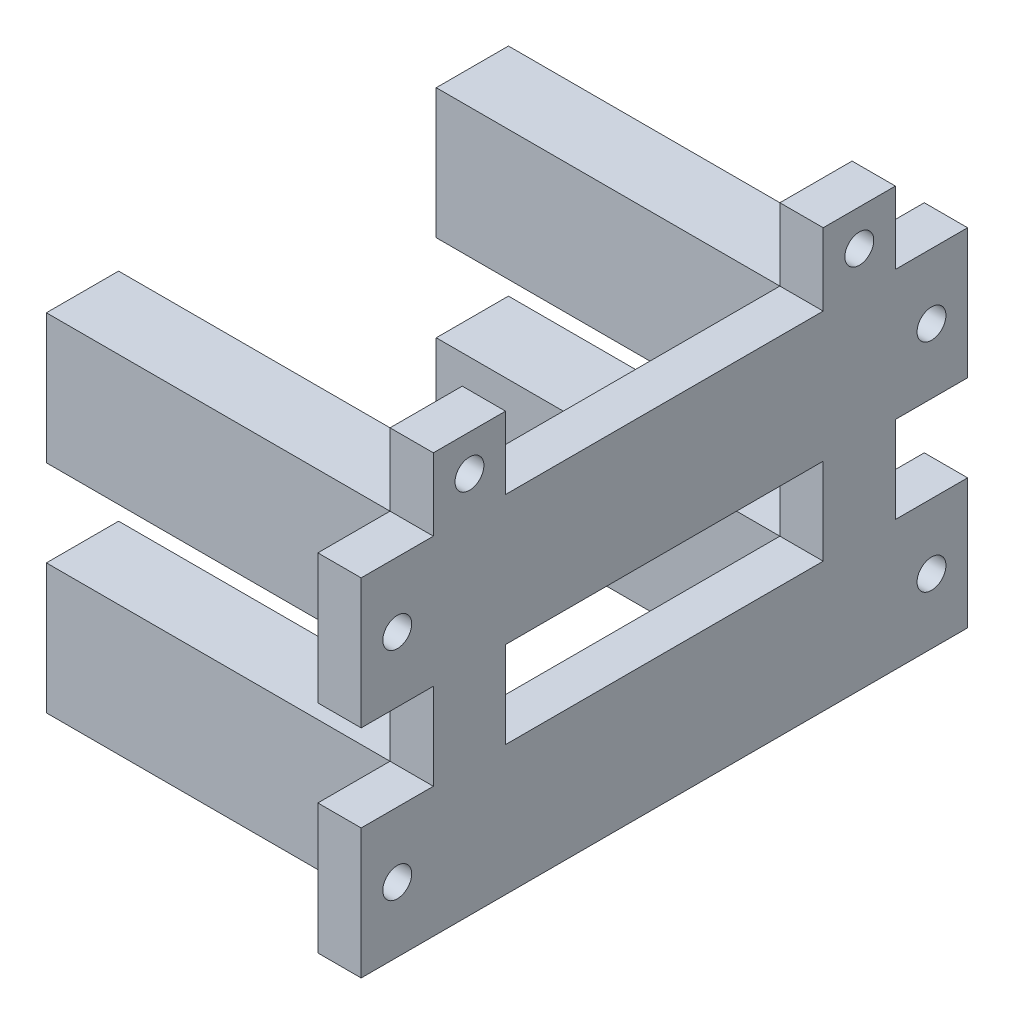
from build123d import *

# Parameters (mm, degrees)
SKETCH_1_W           = 32
SKETCH_1_H           = 24
EXTRUDE_1_DEPTH      = 23.8
SKETCH_7_R           = 0.65
CUT_EXTRUDE_1_DEPTH  = 2
SKETCH_8_OUTSIDE_W   = 43.31
SKETCH_8_OUTSIDE_H   = 35.31
SKETCH_8_OUTSIDE_W_2 = 5
SKETCH_8_OUTSIDE_H_2 = 9
CUT_EXTRUDE_2_DEPTH  = 32.087618114
SKETCH_9_R           = 1
SKETCH_9_W           = 22
SKETCH_9_H           = 6
EXTRUDE_2_DEPTH      = 3
SKETCH_11_R          = 1.75
CUT_EXTRUDE_3_DEPTH  = 1.5


with BuildPart() as part:
    # 草图1 → 凸台-拉伸1 (new body)
    with BuildSketch(Plane(origin=(0, 0, 0), x_dir=(0, 0, -1), z_dir=(1, 0, 0))):
        Rectangle(SKETCH_1_W, SKETCH_1_H)
    extrude(amount=EXTRUDE_1_DEPTH)

    # 草图7 → 切除-拉伸1 (cut)
    with BuildSketch(Plane.ZY):
        with Locations((13.5, 7.5)):
            Circle(SKETCH_7_R)
        with Locations((13.5, -7.5)):
            Circle(SKETCH_7_R)
        with Locations((-13.5, -7.5)):
            Circle(SKETCH_7_R)
        with Locations((-13.5, 7.5)):
            Circle(SKETCH_7_R)
    extrude(amount=-CUT_EXTRUDE_1_DEPTH, mode=Mode.SUBTRACT)

    # 草图8 outside → 切除-拉伸2 (cut, through all)
    with BuildSketch(Plane.ZY):
        Rectangle(SKETCH_8_OUTSIDE_W, SKETCH_8_OUTSIDE_H)
        with Locations((-13.5, -7.5)):
            Rectangle(SKETCH_8_OUTSIDE_W_2, SKETCH_8_OUTSIDE_H_2, mode=Mode.SUBTRACT)
        with Locations((-13.5, 7.5)):
            Rectangle(SKETCH_8_OUTSIDE_W_2, SKETCH_8_OUTSIDE_H_2, mode=Mode.SUBTRACT)
        with Locations((13.5, -7.5)):
            Rectangle(SKETCH_8_OUTSIDE_W_2, SKETCH_8_OUTSIDE_H_2, mode=Mode.SUBTRACT)
        with Locations((13.5, 7.5)):
            Rectangle(SKETCH_8_OUTSIDE_W_2, SKETCH_8_OUTSIDE_H_2, mode=Mode.SUBTRACT)
    extrude(amount=-CUT_EXTRUDE_2_DEPTH, mode=Mode.SUBTRACT)


with BuildPart() as cut_extrude_2_piece_1:
    # of the separate pieces the step leaves, piece 1, a body of its own (cut_extrude_2_pieces)
    add(part.part.solids().sort_by_distance((0, 12, 16))[0])



with BuildPart() as cut_extrude_2_piece_2:
    # of the separate pieces the step leaves, piece 2, a body of its own (cut_extrude_2_pieces)
    add(part.part.solids().sort_by_distance((0, -12, 16))[0])


with BuildPart() as cut_extrude_2_piece_3:
    # of the separate pieces the step leaves, piece 3, a body of its own (cut_extrude_2_pieces)
    add(part.part.solids().sort_by_distance((0, 3, -11))[0])


with BuildPart() as cut_extrude_2_piece_4:
    # of the separate pieces the step leaves, piece 4, a body of its own (cut_extrude_2_pieces)
    add(part.part.solids().sort_by_distance((0, -12, -11))[0])


with BuildPart() as cut_extrude_2_piece_1_1:
    add(cut_extrude_2_piece_1.part)

    add(cut_extrude_2_piece_2.part)  # 凸台-拉伸2 merges 切除-拉伸2 piece 2

    add(cut_extrude_2_piece_3.part)  # 凸台-拉伸2 merges 切除-拉伸2 piece 3

    add(cut_extrude_2_piece_4.part)  # 凸台-拉伸2 merges 切除-拉伸2 piece 4
    # 草图9 → 凸台-拉伸2 (add)
    with BuildSketch(Plane(origin=(23.8, 0, 0), x_dir=(0, 0, -1), z_dir=(1, 0, 0))):
        Polygon((16, -3), (16, 3), (21, 3), (21, 12), (16, 12), (16, 17), (11, 17), (11, 12), (-11, 12), (-11, 17), (-16, 17), (-16, 12), (-21, 12), (-21, 3), (-16, 3), (-16, -3), (-21, -3), (-21, -12), (21, -12), (21, -3), align=None)
        with Locations((18.5, 7.5)):
            Circle(SKETCH_9_R, mode=Mode.SUBTRACT)
        with Locations((13.5, 14.5)):
            Circle(SKETCH_9_R, mode=Mode.SUBTRACT)
        with Locations((-18.5, -7.5)):
            Circle(SKETCH_9_R, mode=Mode.SUBTRACT)
        with Locations((18.5, -7.5)):
            Circle(SKETCH_9_R, mode=Mode.SUBTRACT)
        Rectangle(SKETCH_9_W, SKETCH_9_H, mode=Mode.SUBTRACT)
        with Locations((-18.5, 7.5)):
            Circle(SKETCH_9_R, mode=Mode.SUBTRACT)
        with Locations((-13.5, 14.5)):
            Circle(SKETCH_9_R, mode=Mode.SUBTRACT)
    extrude(amount=EXTRUDE_2_DEPTH)

    # 草图11 → 切除-拉伸3 (cut)
    with BuildSketch(Plane.ZY.offset(-23.8)):
        with Locations((-18.5, -7.5)):
            Circle(SKETCH_11_R)
        with Locations((-13.5, -14.5)):
            Circle(SKETCH_11_R)
        with Locations((-18.546966213, 7.5)):
            Circle(SKETCH_11_R)
        with Locations((13.5, -14.5)):
            Circle(SKETCH_11_R)
        with Locations((18.5, -7.5)):
            Circle(SKETCH_11_R)
        with Locations((18.5, 7.5)):
            Circle(SKETCH_11_R)
        with Locations((13.5, 14.5)):
            Circle(SKETCH_11_R)
        with Locations((-13.5, 14.5)):
            Circle(SKETCH_11_R)
    extrude(amount=-CUT_EXTRUDE_3_DEPTH, mode=Mode.SUBTRACT)


solid = cut_extrude_2_piece_1_1.part
